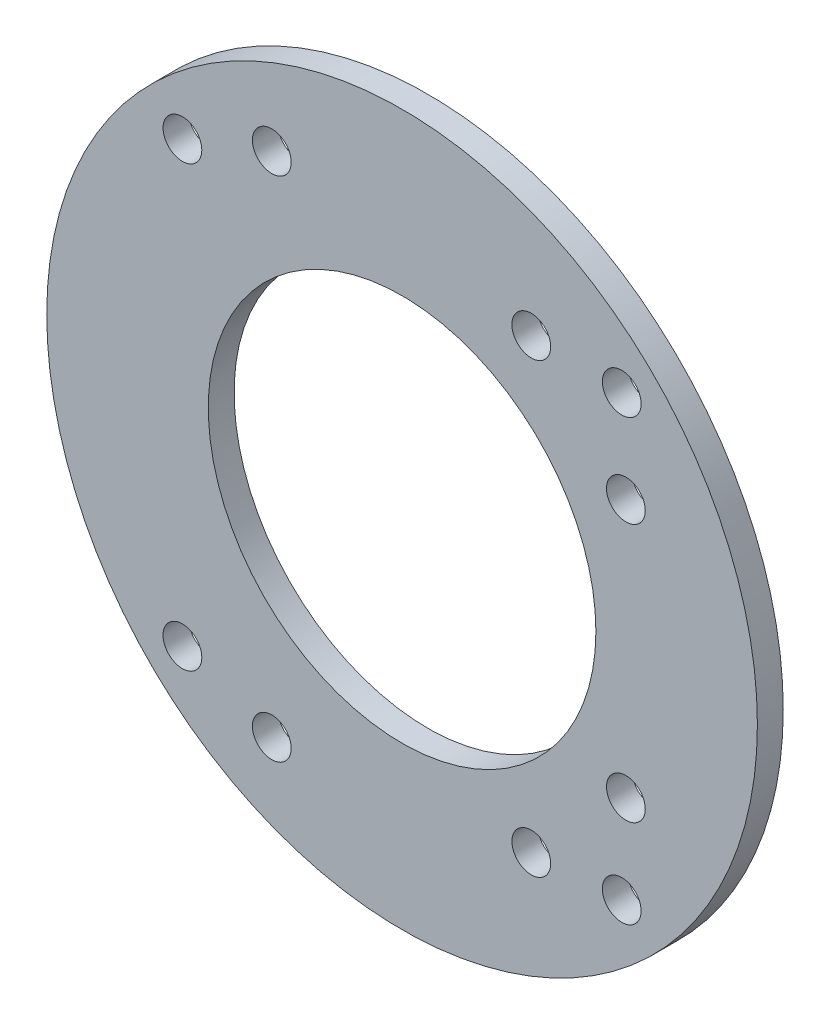
from build123d import *

# Parameters (mm, degrees)
SKETCH_2_R      = 27.5
SKETCH_2_R_2    = 15
SKETCH_2_R_3    = 1.5
EXTRUDE_4_DEPTH = 2


with BuildPart() as part:
    # 草图2 → 凸台-拉伸4 (new body)
    with BuildSketch(Plane.XY):
        with Locations((139.999999999, 2e-09)):
            Circle(SKETCH_2_R)
        with Locations((139.999999999, 2e-09)):
            Circle(SKETCH_2_R_2, mode=Mode.SUBTRACT)
        with Locations((156.999999999, -16.999999998)):
            Circle(SKETCH_2_R_3, mode=Mode.SUBTRACT)
        with Locations((122.999999999, -16.999999998)):
            Circle(SKETCH_2_R_3, mode=Mode.SUBTRACT)
        with Locations((122.999999999, 17.000000002)):
            Circle(SKETCH_2_R_3, mode=Mode.SUBTRACT)
        with Locations((156.999999999, 17.000000002)):
            Circle(SKETCH_2_R_3, mode=Mode.SUBTRACT)
        with Locations((149.999999999, 17.320508077)):
            Circle(SKETCH_2_R_3, mode=Mode.SUBTRACT)
        with Locations((129.917171064, 19.639898968)):
            Circle(SKETCH_2_R_3, mode=Mode.SUBTRACT)
        with Locations((129.917171064, -19.639898965)):
            Circle(SKETCH_2_R_3, mode=Mode.SUBTRACT)
        with Locations((149.999999999, -17.320508074)):
            Circle(SKETCH_2_R_3, mode=Mode.SUBTRACT)
        with Locations((157.320508075, -9.999999999)):
            Circle(SKETCH_2_R_3, mode=Mode.SUBTRACT)
        with Locations((157.320508075, 10.000000001)):
            Circle(SKETCH_2_R_3, mode=Mode.SUBTRACT)
    extrude(amount=EXTRUDE_4_DEPTH)


solid = part.part
